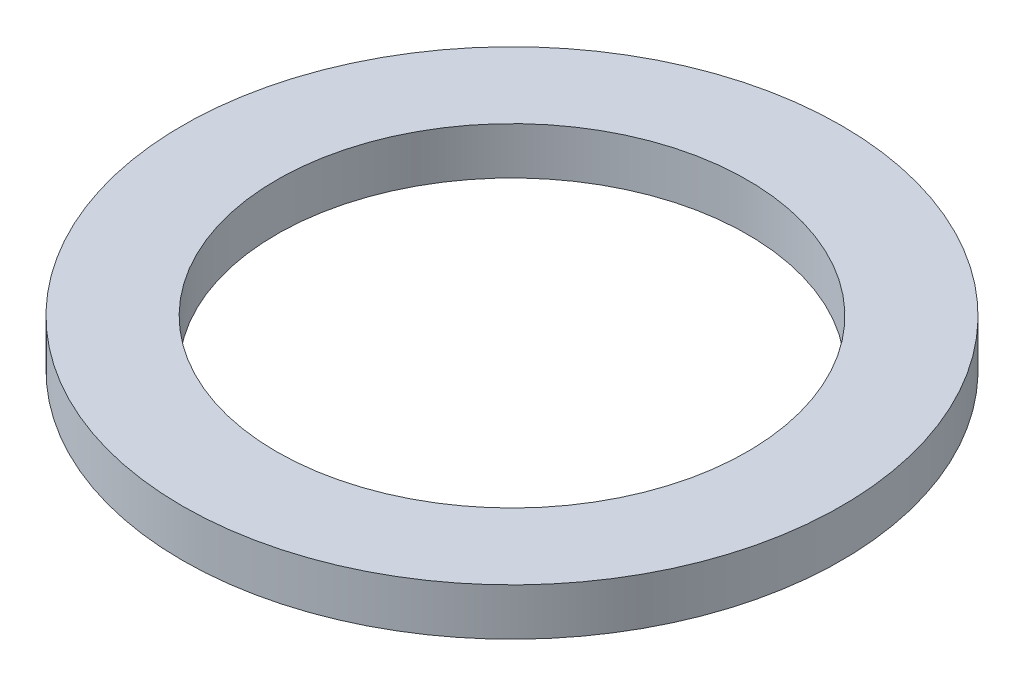
from build123d import *

# Parameters (mm, degrees)
SKETCH_1_R      = 3.5
SKETCH_1_R_2    = 2.5
EXTRUDE_1_DEPTH = 0.5


with BuildPart() as part:
    # 草图1 → 凸台-拉伸1 (new body)
    with BuildSketch(Plane(origin=(0, 0, 0), x_dir=(1, 0, 0), z_dir=(0, 1, 0))):
        with Locations(Location((0, 0, 0), (0, 0, 270))):
            Circle(SKETCH_1_R)
        with Locations(Location((0, 0, 0), (0, 0, 270))):
            Circle(SKETCH_1_R_2, mode=Mode.SUBTRACT)
    extrude(amount=EXTRUDE_1_DEPTH)


solid = part.part
